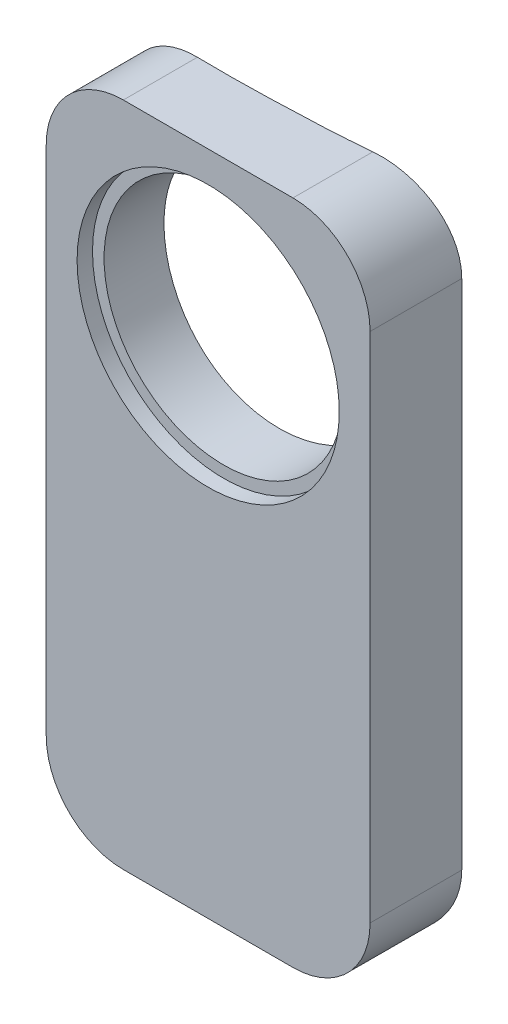
from build123d import *

# Parameters (mm, degrees)
EXTRUDE_1_DEPTH     = 6
CUT_EXTRUDE_5_DEPTH = 45.878603962
SKETCH_4_R          = 7.75
CUT_EXTRUDE_6_DEPTH = 35.872445467
FILLET_1_R          = 5
SKETCH_5_R          = 8.5
CUT_EXTRUDE_7_DEPTH = 1


with BuildPart() as part:
    # 草图1 → 凸台-拉伸1 (new body)
    with BuildSketch(Plane.XY):
        Polygon((-10.499999762, 10.5), (10.500000238, 10.5), (10.500000238, -10.500000475), (10.500000238, -32.718504007), (-10.499999762, -32.718504007), (-10.499999762, -10.499999525), align=None)
    extrude(amount=EXTRUDE_1_DEPTH)

    # 草图8 → 切除-拉伸5 (cut, through all)
    with BuildSketch(Plane(origin=(0, 10.5, 0), x_dir=(1, 0, 0), z_dir=(0, 1, 0))):
        with BuildLine():
            Line((-19.020487649, 0.47662404), (13.656545029, 0.844180338))
            add(Edge.make_bspline(
                [(-19.020487649, 0.47662404), (-14.907938577, -0.444262453), (-8.455698153, -1.333893864), (2.536876626, -1.118098726), (9.340479573, -0.673611335), (13.656545029, 0.844180338)],
                knots=[0, 0, 0, 0, 0.38369485, 0.588358138, 1, 1, 1, 1], degree=3))
        make_face()
    extrude(amount=-CUT_EXTRUDE_5_DEPTH, mode=Mode.SUBTRACT)

    # 草图4 → 切除-拉伸6 (cut, through all)
    with BuildSketch(Plane.XY.offset(6)):
        Circle(SKETCH_4_R)
    extrude(amount=-CUT_EXTRUDE_6_DEPTH, mode=Mode.SUBTRACT)

    # 圆角1
    fillet_1_edges = [part.edges().sort_by_distance(p)[0] for p in [
        (-10.499999762, -32.718504007, 3.451578548),
        (10.500000238, -32.718504007, 3.027756169),
        (10.500000238, 10.5, 3.027756169),
        (-10.499999762, 10.5, 3.451578548),
    ]]
    fillet(fillet_1_edges, radius=FILLET_1_R)

    # 草图5 → 切除-拉伸7 (cut)
    with BuildSketch(Plane.XY.offset(6)):
        Circle(SKETCH_5_R)
    extrude(amount=-CUT_EXTRUDE_7_DEPTH, mode=Mode.SUBTRACT)


solid = part.part
